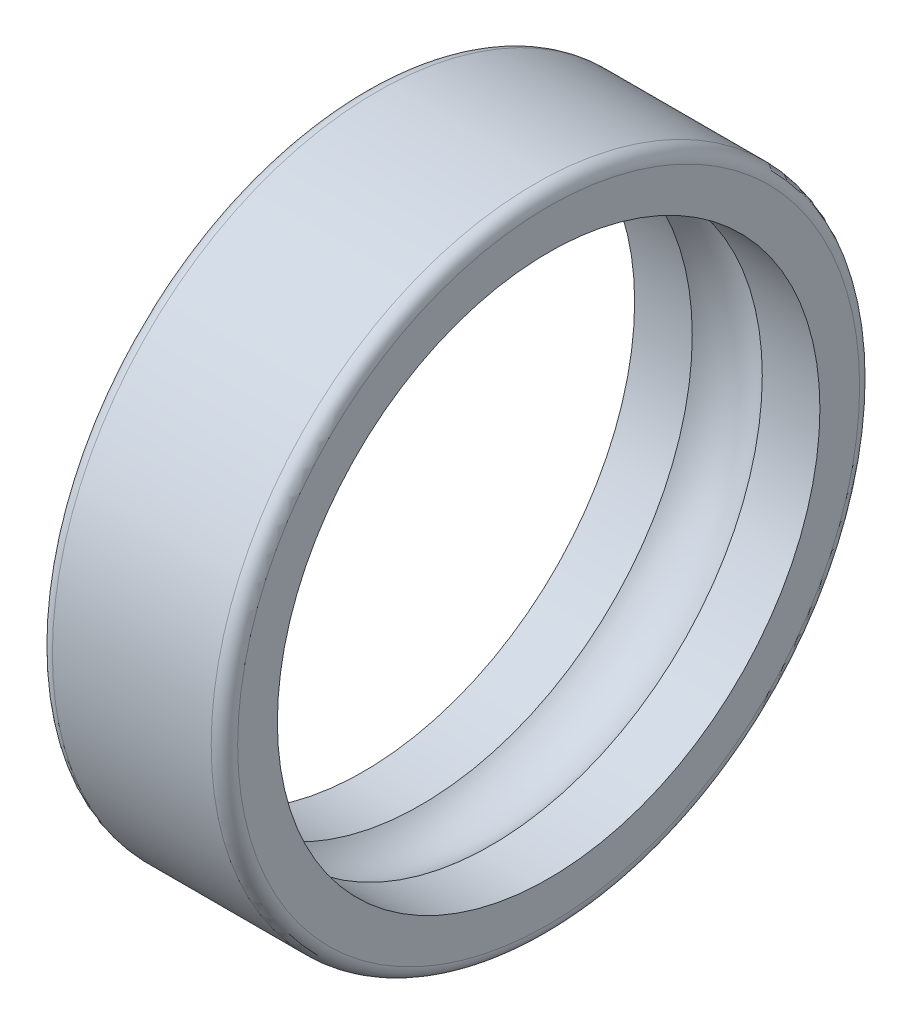
from build123d import *


with BuildPart() as part:
    # Esquisse1 → Base-Révolution (revolve)
    with BuildSketch(Plane.XY, mode=Mode.PRIVATE) as base_r_volution_sk:
        with BuildLine():
            Line((-4.285714286, 17.5), (4.285714286, 17.5))
            ThreePointArc((4.285714286, 17.5), (4.790790558, 17.290790558), (5, 16.785714286))
            Line((5, 16.785714286), (5, 14.642857143))
            Line((5, 14.642857143), (1.889822365, 14.642857143))
            ThreePointArc((1.889822365, 14.642857143), (0, 15.357142857), (-1.889822365, 14.642857143))
            Line((-1.889822365, 14.642857143), (-5, 14.642857143))
            Line((-5, 14.642857143), (-5, 16.785714286))
            ThreePointArc((-5, 16.785714286), (-4.790790558, 17.290790558), (-4.285714286, 17.5))
        make_face()
    revolve(base_r_volution_sk.sketch.rotate(Axis((0, 0, 0), (1, 0, 0)), 90), axis=Axis((0, 0, 0), (1, 0, 0)))


solid = part.part
